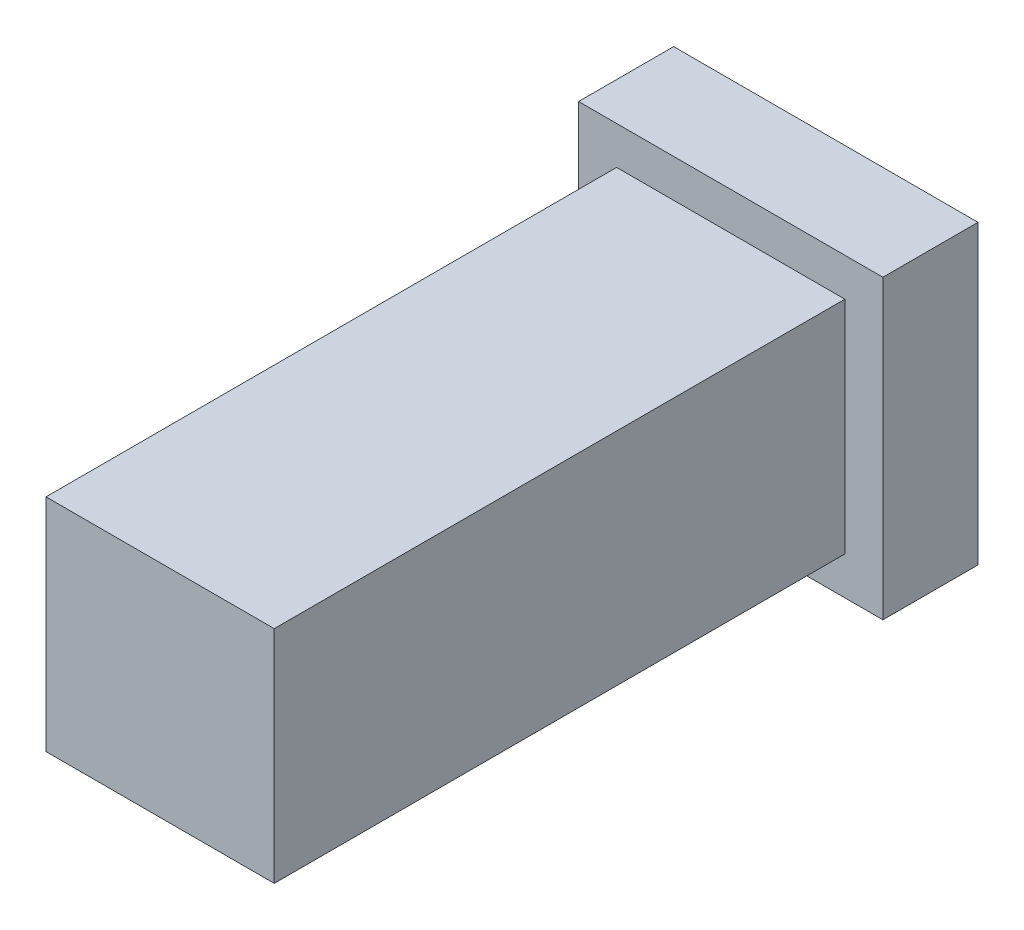
from build123d import *

# Parameters (mm, degrees)
SKETCH1_W           = 6
SKETCH1_H           = 5.8
BOSS_EXTRUDE1_DEPTH = 15
SKETCH2_W           = 8
SKETCH2_H           = 7.8
BOSS_EXTRUDE2_DEPTH = 2.5


with BuildPart() as part:
    # Sketch1 → Boss-Extrude1 (new body)
    with BuildSketch(Plane.XY):
        Rectangle(SKETCH1_W, SKETCH1_H)
    extrude(amount=BOSS_EXTRUDE1_DEPTH)

    # Sketch2 → Boss-Extrude2 (add)
    with BuildSketch(Plane(origin=(0, 0, 0), x_dir=(-1, 0, 0), z_dir=(0, 0, -1))):
        Rectangle(SKETCH2_W, SKETCH2_H)
    extrude(amount=BOSS_EXTRUDE2_DEPTH)


solid = part.part
